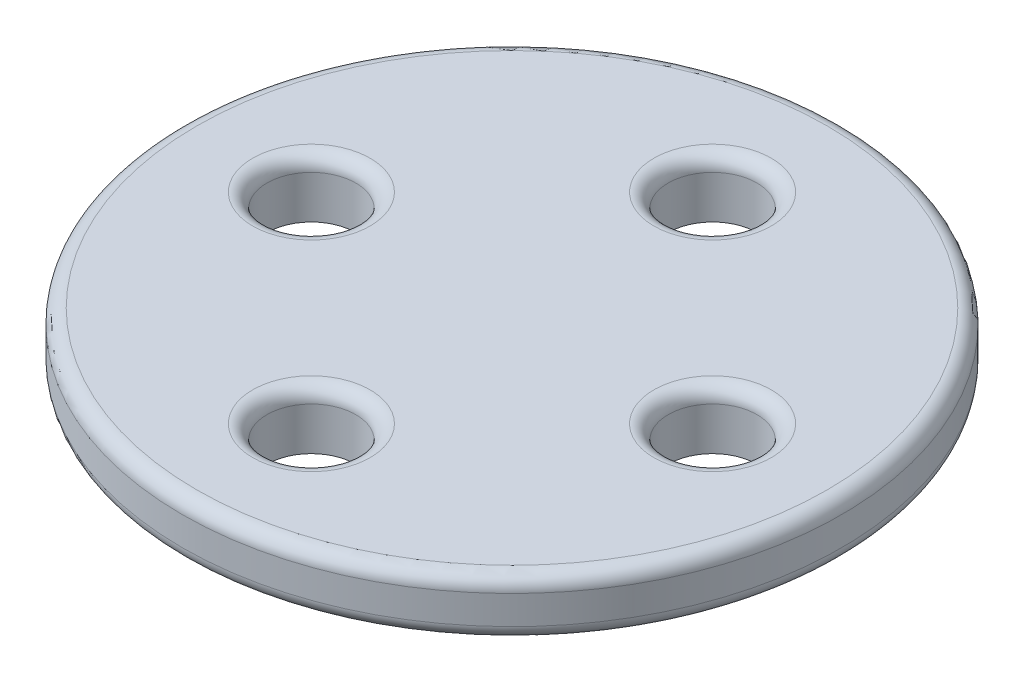
from build123d import *

# Parameters (mm, degrees)
SKETCH1_R           = 11.5
SKETCH1_R_2         = 1.55
BOSS_EXTRUDE1_DEPTH = 2
FILLET1_R           = 0.5


with BuildPart() as part:
    # Sketch1 → Boss-Extrude1 (new body)
    with BuildSketch(Plane(origin=(0, 0, 0), x_dir=(1, 0, 0), z_dir=(0, 1, 0))):
        with Locations(Location((0, 0, 0), (0, 0, 270))):
            Circle(SKETCH1_R)
        with Locations(Location((0, 7, 0), (0, 0, 270))):
            Circle(SKETCH1_R_2, mode=Mode.SUBTRACT)
        with Locations(Location((7, 0, 0), (0, 0, 270))):
            Circle(SKETCH1_R_2, mode=Mode.SUBTRACT)
        with Locations(Location((0, -7, 0), (0, 0, 270))):
            Circle(SKETCH1_R_2, mode=Mode.SUBTRACT)
        with Locations(Location((-7, 0, 0), (0, 0, 270))):
            Circle(SKETCH1_R_2, mode=Mode.SUBTRACT)
    extrude(amount=BOSS_EXTRUDE1_DEPTH)

    # Fillet1
    fillet1_edges = [part.edges().sort_by_distance(p)[0] for p in [
        (0, 2, 5.45),
        (-7, 2, -1.55),
        (0, 0, -11.5),
        (0, 2, -11.5),
        (0, 2, -8.55),
        (7, 2, -1.55),
    ]]
    fillet(fillet1_edges, radius=FILLET1_R)


solid = part.part
